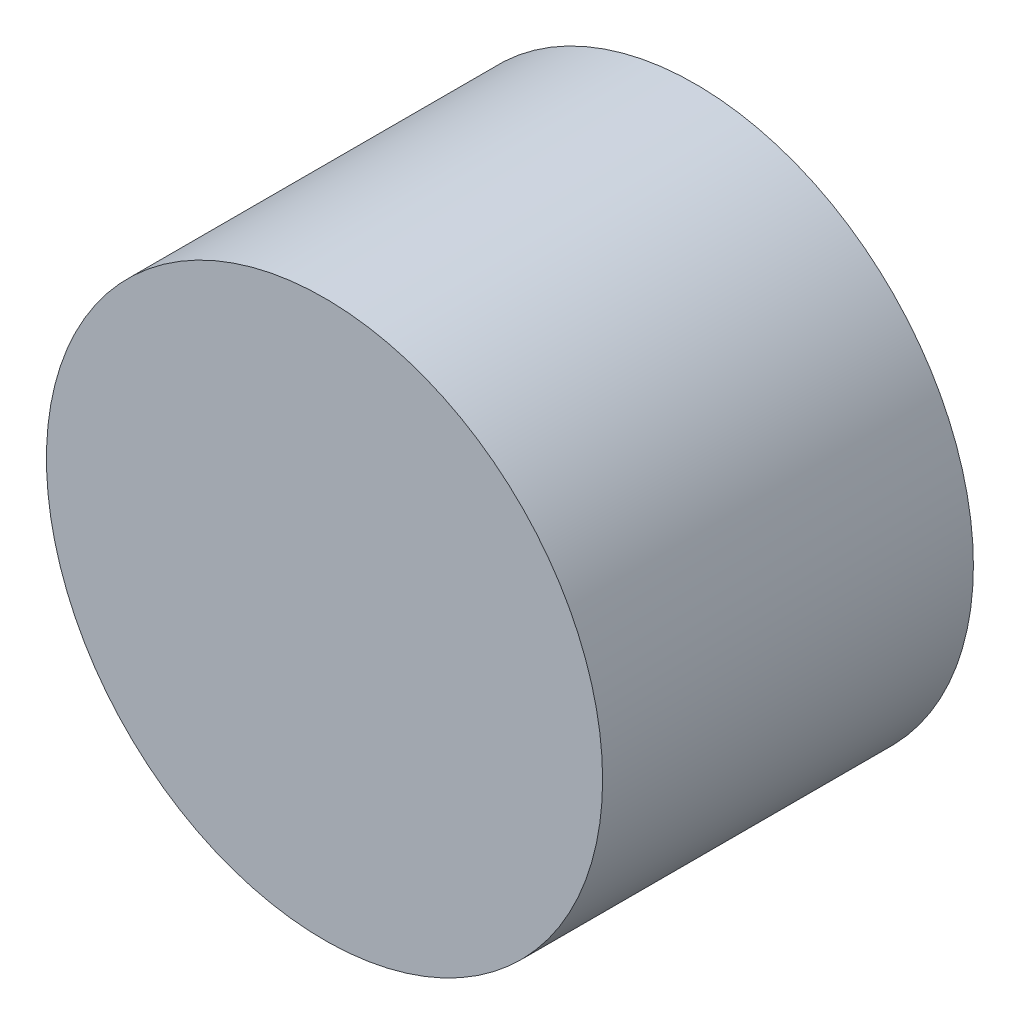
from build123d import *

# Parameters (mm, degrees)
CROQUIS1_R              = 30
SALIENTE_EXTRUIR1_DEPTH = 40


with BuildPart() as part:
    # Croquis1 → Saliente-Extruir1 (new body)
    with BuildSketch(Plane.XY):
        Circle(CROQUIS1_R)
    extrude(amount=SALIENTE_EXTRUIR1_DEPTH)


solid = part.part
